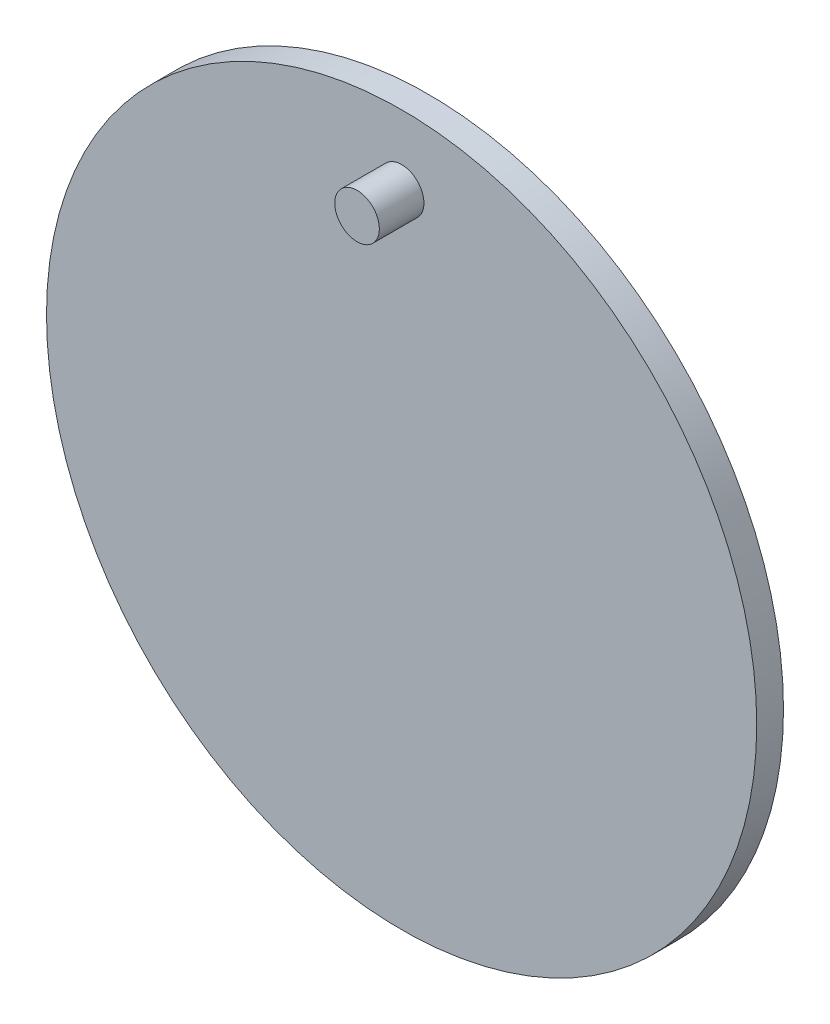
from build123d import *

# Parameters (mm, degrees)
SKETCH_1_R      = 39.83
EXTRUDE_1_DEPTH = 3
SKETCH_2_R      = 2.5
EXTRUDE_2_DEPTH = 5


with BuildPart() as part:
    # 草图1 → 凸台-拉伸1 (new body)
    with BuildSketch(Plane.XY):
        Circle(SKETCH_1_R)
    extrude(amount=EXTRUDE_1_DEPTH)

    # 草图2 → 凸台-拉伸2 (add)
    with BuildSketch(Plane.XY.offset(3)):
        with Locations((0, 32)):
            Circle(SKETCH_2_R)
    extrude(amount=EXTRUDE_2_DEPTH)


solid = part.part
